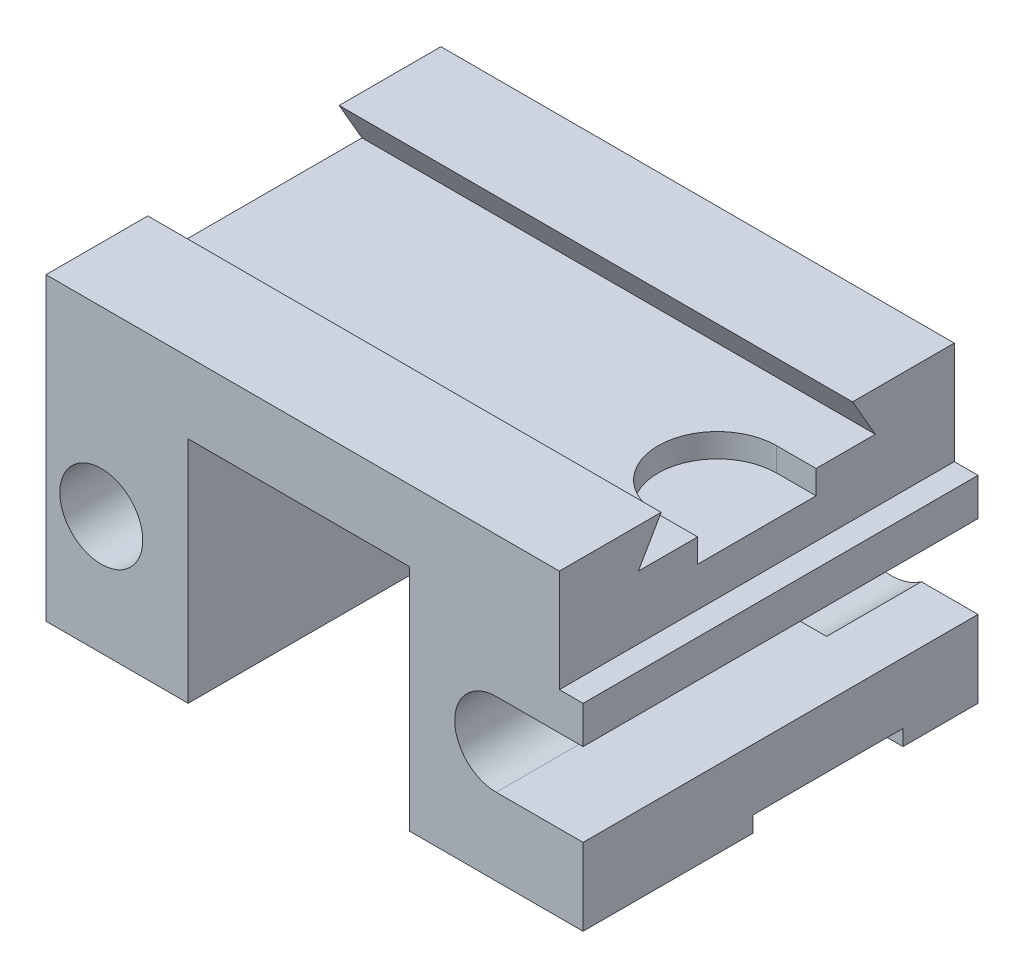
from build123d import *

# Parameters (mm, degrees)
SKETCH1_W           = 6.8
SKETCH1_H           = 5
BOSS_EXTRUDE1_DEPTH = 3.8
SKETCH3_W           = 2.8
SKETCH3_H           = 2.9
CUT_EXTRUDE2_DEPTH  = 10.340235543
SKETCH4_W           = 1.9
SKETCH4_H           = 0.2
CUT_EXTRUDE3_DEPTH  = 2.2
HOLE1_D             = 1.05
HOLE1_CBORE_D       = 1.3
HOLE1_CBORE_DEPTH   = 1.2
CUT_EXTRUDE8_DEPTH  = 10.340235543
CUT_EXTRUDE9_DEPTH  = 10.340235543
CUT_EXTRUDE10_DEPTH = 0.3
SKETCH20_W          = 5
SKETCH20_H          = 1.3
CUT_EXTRUDE11_DEPTH = 0.3


with BuildPart() as part:
    # Sketch1 → Boss-Extrude1 (new body)
    with BuildSketch(Plane(origin=(0, 4, 0), x_dir=(-1, 0, 0), z_dir=(0, 1, 0))):
        with Locations((-3.4, 2.5)):
            Rectangle(SKETCH1_W, SKETCH1_H)
    extrude(amount=-BOSS_EXTRUDE1_DEPTH)

    # Sketch3 → Cut-Extrude2 (cut, through all)
    with BuildSketch(Plane.XY.offset(5)):
        with Locations((3.2, 1.65)):
            Rectangle(SKETCH3_W, SKETCH3_H)
    extrude(amount=-CUT_EXTRUDE2_DEPTH, mode=Mode.SUBTRACT)

    # Sketch4 → Cut-Extrude3 (cut)
    with BuildSketch(Plane(origin=(6.8, 0, 0), x_dir=(0, 0, -1), z_dir=(1, 0, 0))):
        with Locations((-1.9, 0.3)):
            Rectangle(SKETCH4_W, SKETCH4_H)
    extrude(amount=-CUT_EXTRUDE3_DEPTH, mode=Mode.SUBTRACT)

    # Hole1 (through all)
    with Locations(Plane(origin=(0, 0, 0), x_dir=(-1, 0, 0), z_dir=(0, 0, -1))):
        with Locations((-5.7, 1.7), (-0.7, 1.7)):
            CounterBoreHole(HOLE1_D / 2, HOLE1_CBORE_D / 2, HOLE1_CBORE_DEPTH)

    # Sketch17 → Cut-Extrude8 (cut, through all)
    with BuildSketch(Plane.XY.offset(5)):
        with BuildLine():
            Line((6.8, 2.225), (5.7, 2.225))
            ThreePointArc((5.7, 2.225), (6.07123106, 2.07123106), (6.225, 1.7))
            ThreePointArc((6.225, 1.7), (6.07123106, 1.32876894), (5.7, 1.175))
            Line((5.7, 1.175), (6.8, 1.175))
            Line((6.8, 1.175), (6.8, 2.225))
        make_face()
        with BuildLine():
            ThreePointArc((6.225, 1.7), (6.07123106, 2.07123106), (5.7, 2.225))
            Line((5.7, 2.225), (5.7, 1.175))
            ThreePointArc((5.7, 1.175), (6.07123106, 1.32876894), (6.225, 1.7))
        make_face()
        with BuildLine():
            Line((5.7, 1.175), (5.7, 2.225))
            ThreePointArc((5.7, 2.225), (5.175, 1.7), (5.7, 1.175))
        make_face()
    extrude(amount=-CUT_EXTRUDE8_DEPTH, mode=Mode.SUBTRACT)

    # Sketch18 → Cut-Extrude9 (cut, through all)
    with BuildSketch(Plane(origin=(6.8, 0, 0), x_dir=(0, 0, -1), z_dir=(1, 0, 0))):
        Polygon((-1.288675135, 4), (-3.711324865, 4), (-4, 3.5), (-1, 3.5), align=None)
    extrude(amount=-CUT_EXTRUDE9_DEPTH, mode=Mode.SUBTRACT)

    # Sketch19 → Cut-Extrude10 (cut)
    with BuildSketch(Plane(origin=(0, 3.5, 0), x_dir=(1, 0, 0), z_dir=(0, 1, 0))):
        with BuildLine():
            Line((6.8, -1.75), (6, -1.75))
            ThreePointArc((6, -1.75), (6.530330086, -1.969669914), (6.75, -2.5))
            ThreePointArc((6.75, -2.5), (6.530330086, -3.030330086), (6, -3.25))
            Line((6, -3.25), (6.8, -3.25))
            Line((6.8, -3.25), (6.8, -1.75))
        make_face()
        with BuildLine():
            ThreePointArc((6.75, -2.5), (6.530330086, -1.969669914), (6, -1.75))
            Line((6, -1.75), (6, -3.25))
            ThreePointArc((6, -3.25), (6.530330086, -3.030330086), (6.75, -2.5))
        make_face()
        with BuildLine():
            Line((6, -3.25), (6, -1.75))
            ThreePointArc((6, -1.75), (5.25, -2.5), (6, -3.25))
        make_face()
    extrude(amount=-CUT_EXTRUDE10_DEPTH, mode=Mode.SUBTRACT)

    # Sketch20 → Cut-Extrude11 (cut)
    with BuildSketch(Plane(origin=(6.8, 0, 0), x_dir=(0, 0, -1), z_dir=(1, 0, 0))):
        with Locations((-2.5, 3.35)):
            Rectangle(SKETCH20_W, SKETCH20_H)
    extrude(amount=-CUT_EXTRUDE11_DEPTH, mode=Mode.SUBTRACT)


solid = part.part
